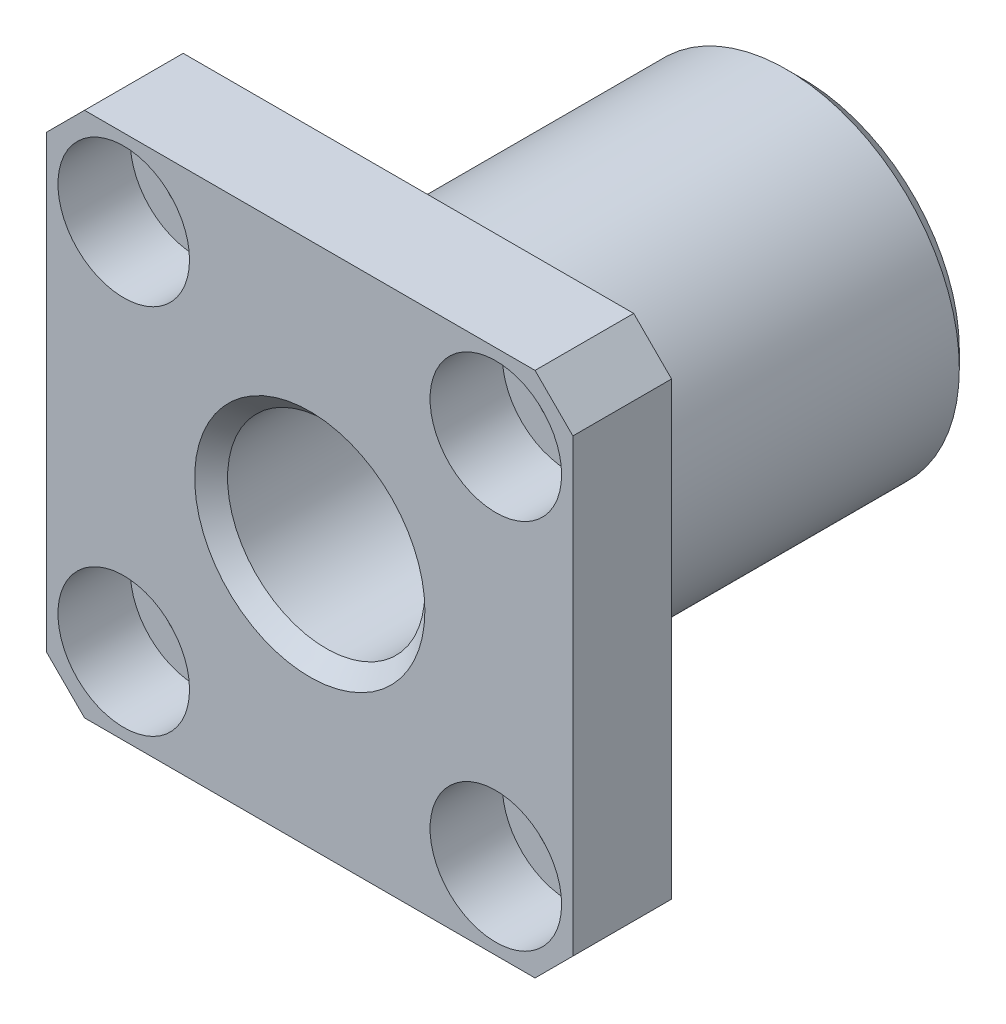
from build123d import *

# Parameters (mm, degrees)
SKETCH1_R                                           = 10.5
BOSS_EXTRUDE1_DEPTH                                 = 30
SKETCH2_W                                           = 32
SKETCH2_H                                           = 32
BOSS_EXTRUDE2_DEPTH                                 = 6
CUT_EXTRUDE1_DEPTH                                  = 38.576588456
CBORE_FOR_M4_HEX_SOCKET_HEAD_CAP_SCREW1_D           = 4.5
CBORE_FOR_M4_HEX_SOCKET_HEAD_CAP_SCREW1_DEPTH       = 22
CBORE_FOR_M4_HEX_SOCKET_HEAD_CAP_SCREW1_CBORE_D     = 8
CBORE_FOR_M4_HEX_SOCKET_HEAD_CAP_SCREW1_CBORE_DEPTH = 4.4
CBORE_FOR_M4_HEX_SOCKET_HEAD_CAP_SCREW1_TIP         = 1.351936393
SKETCH8_R                                           = 6
CUT_EXTRUDE2_DEPTH                                  = 38.576588456
CHAMFER1_SIZE                                       = 1


with BuildPart() as part:
    # Sketch1 → Boss-Extrude1 (new body)
    with BuildSketch(Plane.XY):
        Circle(SKETCH1_R)
    extrude(amount=BOSS_EXTRUDE1_DEPTH)

    # Sketch2 → Boss-Extrude2 (add)
    with BuildSketch(Plane.XY.offset(30)):
        Rectangle(SKETCH2_W, SKETCH2_H)
    extrude(amount=-BOSS_EXTRUDE2_DEPTH)

    # Sketch4 → Cut-Extrude1 (cut, through all)
    with BuildSketch(Plane.XY.offset(30)):
        Polygon((-16, 16), (-16, 13.69848481), (-13.69848481, 16), align=None)
        Polygon((13.69848481, 16), (16, 16), (16, 13.69848481), align=None)
        Polygon((16, -16), (16, -13.69848481), (13.69848481, -16), align=None)
        Polygon((-13.69848481, -16), (-16, -16), (-16, -13.69848481), align=None)
    extrude(amount=-CUT_EXTRUDE1_DEPTH, mode=Mode.SUBTRACT)

    # CBORE for M4 Hex Socket Head Cap Screw1
    with Locations(Plane.XY.offset(30)):
        with Locations((-11.313708499, 11.313708499), (11.313708499, 11.313708499), (11.313708499, -11.313708499), (-11.313708499, -11.313708499)):
            CounterBoreHole(CBORE_FOR_M4_HEX_SOCKET_HEAD_CAP_SCREW1_D / 2, CBORE_FOR_M4_HEX_SOCKET_HEAD_CAP_SCREW1_CBORE_D / 2, CBORE_FOR_M4_HEX_SOCKET_HEAD_CAP_SCREW1_CBORE_DEPTH, depth=CBORE_FOR_M4_HEX_SOCKET_HEAD_CAP_SCREW1_DEPTH)
            with Locations((0, 0, -(CBORE_FOR_M4_HEX_SOCKET_HEAD_CAP_SCREW1_DEPTH + CBORE_FOR_M4_HEX_SOCKET_HEAD_CAP_SCREW1_TIP / 2))):  # 118° drill point
                Cone(0, CBORE_FOR_M4_HEX_SOCKET_HEAD_CAP_SCREW1_D / 2, CBORE_FOR_M4_HEX_SOCKET_HEAD_CAP_SCREW1_TIP, mode=Mode.SUBTRACT)

    # Sketch8 → Cut-Extrude2 (cut, through all)
    with BuildSketch(Plane.XY.offset(30)):
        Circle(SKETCH8_R)
    extrude(amount=-CUT_EXTRUDE2_DEPTH, mode=Mode.SUBTRACT)

    # Chamfer1
    chamfer1_edges = [part.edges().sort_by_distance(p)[0] for p in [
        (-6, 0, 30),
        (-10.5, 0, 0),
    ]]
    chamfer(chamfer1_edges, length=CHAMFER1_SIZE)


solid = part.part
